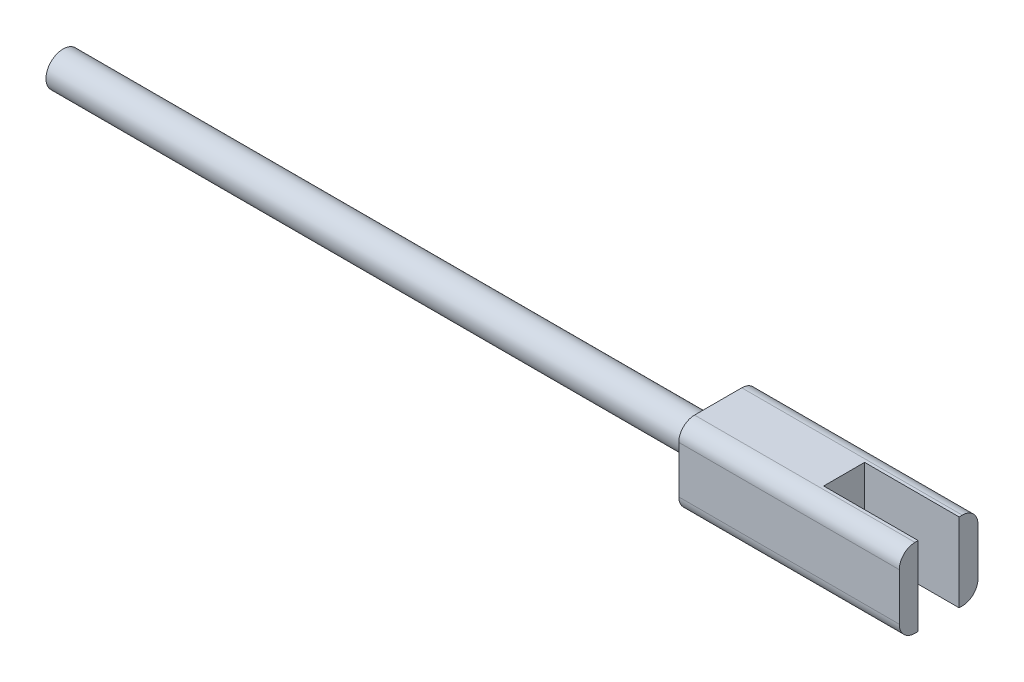
from build123d import *

# Parameters (mm, degrees)
SKETCH1_R               = 1.09
BOSS_EXTRUDE1_DEPTH     = 43.594
BOSS_EXTRUDE2_DEPTH     = 14
CUT_EXTRUDE1_DEPTH      = 56.706308763
CUT_EXTRUDE1_DEPTH_BACK = 56.706308763
SKETCH3_W               = 7
SKETCH3_H               = 2.6


with BuildPart() as part:
    # Sketch1 → Boss-Extrude1 (new body)
    with BuildSketch(Plane(origin=(0, 0, 0), x_dir=(0, 0, -1), z_dir=(1, 0, 0))):
        Circle(SKETCH1_R)
    extrude(amount=BOSS_EXTRUDE1_DEPTH)

    # Sketch2 → Boss-Extrude2 (add)
    with BuildSketch(Plane(origin=(41.594, 0, 0), x_dir=(0, 0, -1), z_dir=(1, 0, 0))):
        with BuildLine():
            Line((-1.5, -2.5), (1.5, -2.5))
            ThreePointArc((1.5, -2.5), (2.207106781, -2.207106781), (2.5, -1.5))
            Line((2.5, -1.5), (2.5, 1.5))
            ThreePointArc((2.5, 1.5), (2.207106781, 2.207106781), (1.5, 2.5))
            Line((1.5, 2.5), (-1.5, 2.5))
            ThreePointArc((-1.5, 2.5), (-2.207106781, 2.207106781), (-2.5, 1.5))
            Line((-2.5, 1.5), (-2.5, -1.5))
            ThreePointArc((-2.5, -1.5), (-2.207106781, -2.207106781), (-1.5, -2.5))
        make_face()
    extrude(amount=BOSS_EXTRUDE2_DEPTH)

    # Sketch3 → Cut-Extrude1 (cut, two sides: drawn at the far end of the back side and taken through both)
    with BuildSketch(Plane(origin=(0, 0, 0), x_dir=(1, 0, 0), z_dir=(0, 1, 0)).offset(-CUT_EXTRUDE1_DEPTH_BACK)):
        with Locations((53.094, 0)):
            Rectangle(SKETCH3_W, SKETCH3_H)
    extrude(amount=CUT_EXTRUDE1_DEPTH + CUT_EXTRUDE1_DEPTH_BACK, mode=Mode.SUBTRACT)


solid = part.part
